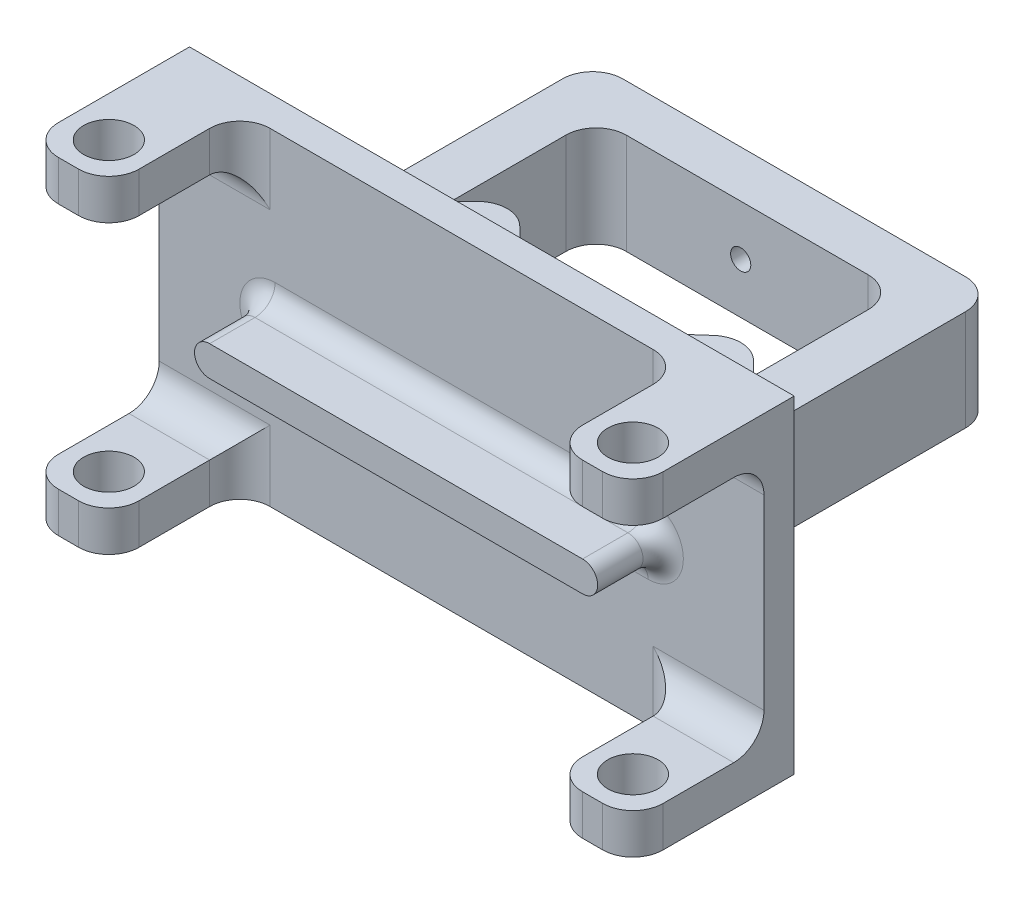
from build123d import *

# Parameters (mm, degrees)
SKETCH2_W           = 60
SKETCH2_H           = 32.5
BOSS_EXTRUDE1_DEPTH = 3
SKETCH3_W           = 8
SKETCH3_H           = 4
BOSS_EXTRUDE2_DEPTH = 13
FILLET1_R           = 3
SKETCH4_R           = 2.5
CUT_EXTRUDE1_DEPTH  = 13
SKETCH5_R           = 2.5
CUT_EXTRUDE2_DEPTH  = 13
FILLET2_R           = 3
BOSS_EXTRUDE3_DEPTH = 6.5
FILLET3_R           = 2
SKETCH7_W           = 40
SKETCH7_H           = 10
BOSS_EXTRUDE4_DEPTH = 30
CUT_EXTRUDE3_DEPTH  = 30
FILLET5_R           = 3
SKETCH9_R           = 1
CUT_EXTRUDE4_DEPTH  = 5
FILLET6_R           = 3
FILLET7_R           = 3
FILLET8_R           = 3


with BuildPart() as part:
    # Sketch2 → Boss-Extrude1 (new body)
    with BuildSketch(Plane.XY):
        with Locations((-25.634473236, 6.404480792)):
            Rectangle(SKETCH2_W, SKETCH2_H)
    extrude(amount=BOSS_EXTRUDE1_DEPTH)

    # Sketch3 → Boss-Extrude2 (add)
    with BuildSketch(Plane.XY.offset(3)):
        with Locations((0.365526764, 20.654480792)):
            Rectangle(SKETCH3_W, SKETCH3_H)
        with Locations((0.365526764, -7.845519208)):
            Rectangle(SKETCH3_W, SKETCH3_H)
        with Locations((-51.634473236, 20.654480792)):
            Rectangle(SKETCH3_W, SKETCH3_H)
        with Locations((-51.634473236, -7.845519208)):
            Rectangle(SKETCH3_W, SKETCH3_H)
    extrude(amount=BOSS_EXTRUDE2_DEPTH)

    # Fillet1
    fillet1_edges = [part.edges().sort_by_distance(p)[0] for p in [
        (-55.634473236, 20.654480792, 16),
        (-47.634473236, 20.654480792, 16),
        (-55.634473236, -7.845519208, 16),
        (-47.634473236, -7.845519208, 16),
        (-3.634473236, -7.845519208, 16),
        (4.365526764, -7.845519208, 16),
        (-3.634473236, 20.654480792, 16),
        (4.365526764, 20.654480792, 16),
    ]]
    fillet(fillet1_edges, radius=FILLET1_R)

    # Sketch4 → Cut-Extrude1 (cut)
    with BuildSketch(Plane(origin=(0, 22.654480792, 0), x_dir=(1, 0, 0), z_dir=(0, 1, 0))):
        with Locations((0.365526764, -12)):
            Circle(SKETCH4_R)
        with Locations((-51.634473236, -12)):
            Circle(SKETCH4_R)
    extrude(amount=-CUT_EXTRUDE1_DEPTH, mode=Mode.SUBTRACT)

    # Sketch5 → Cut-Extrude2 (cut)
    with BuildSketch(Plane(origin=(0, -5.845519208, 0), x_dir=(1, 0, 0), z_dir=(0, 1, 0))):
        with Locations((-51.634473236, -12)):
            Circle(SKETCH5_R)
        with Locations((0.365526764, -12)):
            Circle(SKETCH5_R)
    extrude(amount=-CUT_EXTRUDE2_DEPTH, mode=Mode.SUBTRACT)

    # Fillet2
    fillet2_edges = [part.edges().sort_by_distance(p)[0] for p in [
        (-51.634473236, 18.654480792, 3),
        (-47.634473236, 20.654480792, 3),
        (-47.634473236, -7.845519208, 3),
        (-51.634473236, -5.845519208, 3),
        (-3.634473236, -7.845519208, 3),
        (0.365526764, -5.845519208, 3),
        (0.365526764, 18.654480792, 3),
        (-3.634473236, 20.654480792, 3),
    ]]
    fillet(fillet2_edges, radius=FILLET2_R)

    # Sketch6 → Boss-Extrude3 (add)
    with BuildSketch(Plane.XY.offset(3)):
        with BuildLine():
            Line((-44.134473236, 7.654480792), (-7.134473236, 7.654480792))
            ThreePointArc((-7.134473236, 7.654480792), (-5.634473236, 6.154480792), (-7.134473236, 4.654480792))
            Line((-7.134473236, 4.654480792), (-44.134473236, 4.654480792))
            ThreePointArc((-44.134473236, 4.654480792), (-45.634473236, 6.154480792), (-44.134473236, 7.654480792))
        make_face()
    extrude(amount=BOSS_EXTRUDE3_DEPTH)

    # Fillet3
    fillet3_edges = [part.edges().sort_by_distance(p)[0] for p in [
        (-5.634473236, 6.154480792, 3),
        (-25.634473236, 4.654480792, 3),
        (-45.634473236, 6.154480792, 3),
        (-25.634473236, 7.654480792, 3),
    ]]
    fillet(fillet3_edges, radius=FILLET3_R)

    # Sketch7 → Boss-Extrude4 (add)
    with BuildSketch(Plane(origin=(0, 0, 0), x_dir=(-1, 0, 0), z_dir=(0, 0, -1))):
        with Locations((25.634473236, 6.404480792)):
            Rectangle(SKETCH7_W, SKETCH7_H)
    extrude(amount=BOSS_EXTRUDE4_DEPTH)

    # Sketch8 → Cut-Extrude3 (cut)
    with BuildSketch(Plane(origin=(0, 11.404480792, 0), x_dir=(1, 0, 0), z_dir=(0, 1, 0))):
        Polygon((-10.634473236, 10.954417446), (-13.99795844, 14.31790265), (-26.284293259, 3.42037636), (-37.226403791, 14.362486892), (-40.634473236, 10.954417446), (-40.634473236, 25.339784932), (-10.634473236, 25.339784932), align=None)
    extrude(amount=-CUT_EXTRUDE3_DEPTH, mode=Mode.SUBTRACT)

    # Fillet5
    fillet5_edges = [part.edges().sort_by_distance(p)[0] for p in [
        (-10.634473236, 6.404480792, -25.339784932),
        (-40.634473236, 6.404480792, -25.339784932),
    ]]
    fillet(fillet5_edges, radius=FILLET5_R)

    # Sketch9 → Cut-Extrude4 (cut)
    with BuildSketch(Plane(origin=(0, 0, -30), x_dir=(-1, 0, 0), z_dir=(0, 0, -1))):
        with Locations((26.284293259, 6.404480792)):
            Circle(SKETCH9_R)
    extrude(amount=-CUT_EXTRUDE4_DEPTH, mode=Mode.SUBTRACT)

    # Fillet6
    fillet6_edges = [part.edges().sort_by_distance(p)[0] for p in [
        (-37.226403791, 6.404480792, -14.362486892),
        (-13.99795844, 6.404480792, -14.31790265),
        (-26.284293259, 6.404480792, -3.42037636),
    ]]
    fillet(fillet6_edges, radius=FILLET6_R)

    # Fillet7
    fillet7_edges = [part.edges().sort_by_distance(p)[0] for p in [
        (-5.634473236, 6.404480792, 0),
        (-25.634473236, 1.404480792, 0),
        (-45.634473236, 6.404480792, 0),
        (-25.634473236, 11.404480792, 0),
    ]]
    fillet(fillet7_edges, radius=FILLET7_R)

    # Fillet8
    fillet8_edges = [part.edges().sort_by_distance(p)[0] for p in [
        (-5.634473236, 6.404480792, -30),
        (-45.634473236, 6.404480792, -30),
    ]]
    fillet(fillet8_edges, radius=FILLET8_R)


solid = part.part
